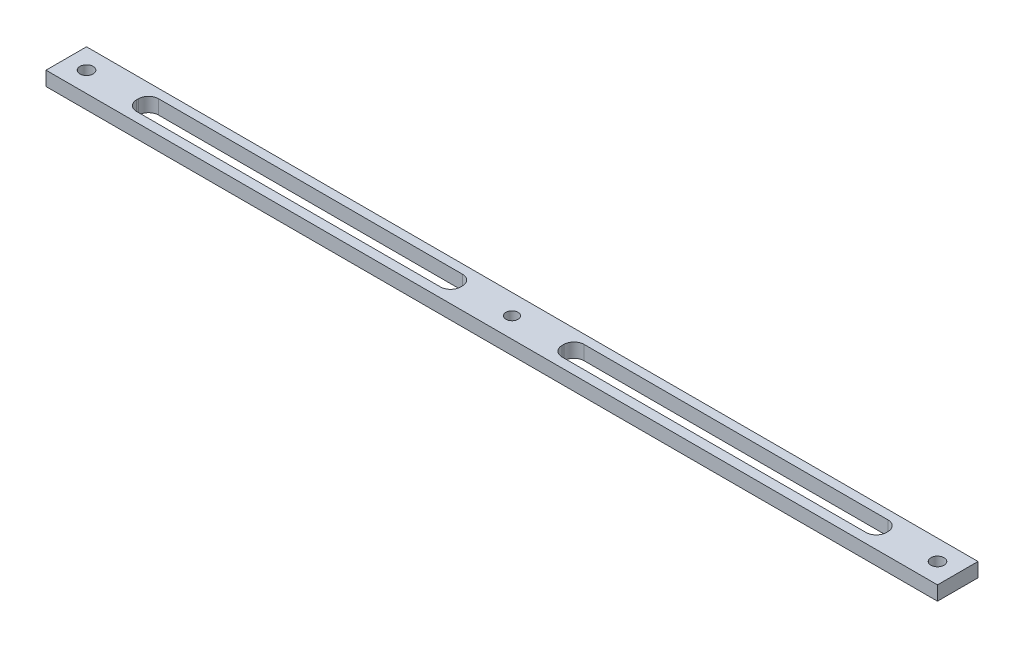
from build123d import *

# Parameters (mm, degrees)
SZKIC1_W                    = 440
SZKIC1_H                    = 20
SZKIC1_R                    = 3
SZKIC1_R_2                  = 3.25
DODANIE_WYCI_GNI_CIE1_DEPTH = 7


with BuildPart() as part:
    # Szkic1 → Dodanie-wyciągnięcie1 (new body)
    with BuildSketch(Plane(origin=(0, 0, 0), x_dir=(1, 0, 0), z_dir=(0, 1, 0))):
        with Locations((220, 10)):
            Rectangle(SZKIC1_W, SZKIC1_H)
        with Locations(Location((220, 10, 0), (0, 0, 270))):
            Circle(SZKIC1_R, mode=Mode.SUBTRACT)
        with Locations(Location((10, 10, 0), (0, 0, 270))):
            Circle(SZKIC1_R_2, mode=Mode.SUBTRACT)
        with Locations(Location((430, 10, 0), (0, 0, 270))):
            Circle(SZKIC1_R_2, mode=Mode.SUBTRACT)
        with BuildLine():
            Line((40, 15.57457628), (190, 15.57457628))
            ThreePointArc((190, 15.57457628), (193.535533906, 14.110110186), (195, 10.57457628))
            Line((195, 10.57457628), (195, 9.696719379))
            ThreePointArc((195, 9.696719379), (193.535533906, 6.161185473), (190, 4.696719379))
            Line((190, 4.696719379), (40, 4.696719379))
            ThreePointArc((40, 4.696719379), (36.464466094, 6.161185473), (35, 9.696719379))
            Line((35, 9.696719379), (35, 10.57457628))
            ThreePointArc((35, 10.57457628), (36.464466094, 14.110110186), (40, 15.57457628))
        make_face(mode=Mode.SUBTRACT)
        with BuildLine():
            Line((250, 15.57457628), (400, 15.57457628))
            ThreePointArc((400, 15.57457628), (403.535533906, 14.110110186), (405, 10.57457628))
            Line((405, 10.57457628), (405, 9.752776346))
            ThreePointArc((405, 9.752776346), (403.535533906, 6.21724244), (400, 4.752776346))
            Line((400, 4.752776346), (250, 4.752776346))
            ThreePointArc((250, 4.752776346), (246.464466094, 6.21724244), (245, 9.752776346))
            Line((245, 9.752776346), (245, 10.57457628))
            ThreePointArc((245, 10.57457628), (246.464466094, 14.110110186), (250, 15.57457628))
        make_face(mode=Mode.SUBTRACT)
    extrude(amount=DODANIE_WYCI_GNI_CIE1_DEPTH)


solid = part.part
